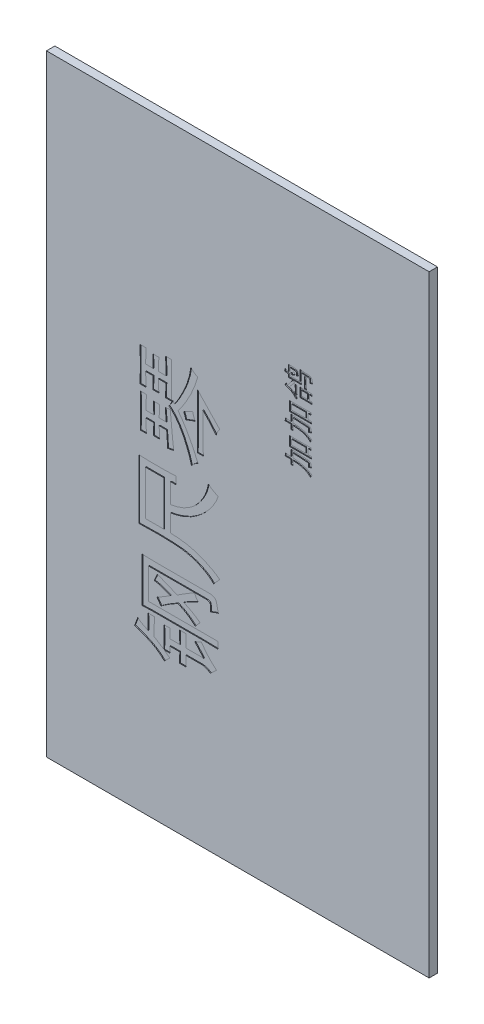
from build123d import *

# Parameters (mm, degrees)
SKETCH_1_W          = 91.41993269
SKETCH_1_H          = 146.13
EXTRUDE_1_DEPTH     = 2
SKETCH_4_W          = 4.425194932
SKETCH_4_H          = 10.637487817
SKETCH_4_W_2        = 3.375629467
SKETCH_4_H_2        = 1.219765269
SKETCH_4_H_3        = 1.21976527
SKETCH_4_W_3        = 1.389965074
SKETCH_4_H_4        = 1.163032001
CUT_EXTRUDE_1_DEPTH = 0.2


with BuildPart() as part:
    # 草图1 → 凸台-拉伸1 (new body)
    with BuildSketch(Plane.XY):
        with Locations((-20.419966345, 50.685)):
            Rectangle(SKETCH_1_W, SKETCH_1_H)
    extrude(amount=EXTRUDE_1_DEPTH)

    # 草图4 → 切除-拉伸1 (cut)
    # profile 1 of 18: a face of its own
    with BuildSketch(Plane.XY.offset(2)):
        with BuildLine():
            add(Edge.make_bspline(
                [(-43.803001095, 66.025521944), (-43.78954932, 66.259769099), (-43.763499272, 66.713400678), (-43.739446042, 67.373344913), (-43.722516649, 67.990088426), (-43.719401077, 68.387296809), (-43.717901192, 68.57851902)],
                knots=[0, 0, 0, 0, 1.102078905, 2.134232082, 3.101790691, 4, 4, 4, 4], degree=3))
            Line((-43.717901192, 68.57851902), (-43.717901192, 71.386815804))
            add(Edge.make_bspline(
                [(-43.717901192, 71.386815804), (-43.719451638, 71.58328983), (-43.722751909, 72.001503353), (-43.739910631, 72.666560951), (-43.763981957, 73.406319764), (-43.789594281, 73.924086656), (-43.803001095, 74.195112587)],
                knots=[0, 0, 0, 0, 0.839097459, 1.786098198, 2.841129462, 4, 4, 4, 4], degree=3))
            Line((-43.803001095, 74.195112587), (-42.356302752, 74.195112587))
            add(Edge.make_bspline(
                [(-42.356302752, 74.195112587), (-42.36258684, 74.084798646), (-42.375691967, 73.854744846), (-42.396549739, 73.495593189), (-42.406339895, 73.10980798), (-42.420623896, 72.697000018), (-42.429638044, 72.258855256), (-42.434725536, 71.793402438), (-42.443228198, 71.301741132), (-42.442022421, 70.964472132), (-42.441402654, 70.791116486)],
                knots=[0, 0, 0, 0, 0.778675858, 1.623886681, 2.535045647, 3.498005879, 4.534787375, 5.623258821, 6.778359398, 8, 8, 8, 8], degree=3))
            Line((-42.441402654, 70.791116486), (-40.654304701, 70.791116486))
            add(Edge.make_bspline(
                [(-40.654304701, 70.791116486), (-40.655546846, 71.087402285), (-40.657894779, 71.647449143), (-40.674245434, 72.439654889), (-40.695958691, 73.136587474), (-40.725636498, 73.56900586), (-40.739404603, 73.769613075)],
                knots=[0, 0, 0, 0, 1.192950867, 2.25494569, 3.190435709, 4, 4, 4, 4], degree=3))
            Line((-40.739404603, 73.769613075), (-39.29270626, 73.769613075))
            add(Edge.make_bspline(
                [(-39.29270626, 73.769613075), (-39.299041866, 73.6855686), (-39.312500843, 73.507029607), (-39.333330533, 73.22144772), (-39.343002428, 72.900738993), (-39.357077227, 72.54572356), (-39.366222589, 72.155900934), (-39.371148659, 71.732466825), (-39.379685512, 71.273376803), (-39.378448971, 70.956067673), (-39.377806163, 70.791116486)],
                knots=[0, 0, 0, 0, 0.678691969, 1.44177213, 2.305344128, 3.261910389, 4.302786264, 5.444996677, 6.671797342, 8, 8, 8, 8], degree=3))
            Line((-39.377806163, 70.791116486), (-37.59070821, 70.791116486))
            Line((-37.59070821, 70.791116486), (-37.59070821, 72.578214439))
            add(Edge.make_bspline(
                [(-37.59070821, 72.578214439), (-37.591978664, 72.794656729), (-37.594396587, 73.206588878), (-37.610664487, 73.791842977), (-37.632712425, 74.313415584), (-37.662063175, 74.638551137), (-37.675808112, 74.790811905)],
                knots=[0, 0, 0, 0, 1.172564309, 2.231619973, 3.171868786, 4, 4, 4, 4], degree=3))
            Line((-37.675808112, 74.790811905), (-36.229109769, 74.790811905))
            add(Edge.make_bspline(
                [(-36.229109769, 74.790811905), (-36.242854706, 74.638551137), (-36.272205456, 74.313415584), (-36.294253394, 73.791842977), (-36.310521294, 73.206588878), (-36.312939217, 72.794656729), (-36.314209672, 72.578214439)],
                knots=[0, 0, 0, 0, 0.828131214, 1.768380027, 2.827435691, 4, 4, 4, 4], degree=3))
            Line((-36.314209672, 72.578214439), (-36.314209672, 69.174218338))
            add(Edge.make_bspline(
                [(-36.314209672, 69.174218338), (-36.314712838, 69.083859877), (-36.315771949, 68.893664719), (-36.306908623, 68.594293319), (-36.302141024, 68.26645314), (-36.292328756, 67.909236835), (-36.278501787, 67.522684967), (-36.268290591, 67.106479875), (-36.2467732, 66.661193688), (-36.235130265, 66.354375639), (-36.229109769, 66.195721749)],
                knots=[0, 0, 0, 0, 0.727693904, 1.53171994, 2.411884578, 3.368377428, 4.409699142, 5.527137373, 6.721296624, 8, 8, 8, 8], degree=3))
            Line((-36.229109769, 66.195721749), (-37.675808112, 66.195721749))
            add(Edge.make_bspline(
                [(-37.675808112, 66.195721749), (-37.662280682, 66.461489468), (-37.635554544, 66.986566652), (-37.61198161, 67.763138138), (-37.595049505, 68.518560676), (-37.592142904, 69.014515593), (-37.59070821, 69.25931824)],
                knots=[0, 0, 0, 0, 1.041813808, 2.058311158, 3.041585129, 4, 4, 4, 4], degree=3))
            Line((-37.59070821, 69.25931824), (-39.377806163, 69.25931824))
            add(Edge.make_bspline(
                [(-39.377806163, 69.25931824), (-39.376518933, 68.986146588), (-39.374048217, 68.461819632), (-39.357522396, 67.706384222), (-39.335273965, 67.014761582), (-39.306418967, 66.574938068), (-39.29270626, 66.365921554)],
                knots=[0, 0, 0, 0, 1.132231955, 2.173211342, 3.131858611, 4, 4, 4, 4], degree=3))
            Line((-39.29270626, 66.365921554), (-40.739404603, 66.365921554))
            add(Edge.make_bspline(
                [(-40.739404603, 66.365921554), (-40.725651648, 66.564427427), (-40.69620186, 66.989496495), (-40.67430462, 67.670660929), (-40.657961331, 68.436603985), (-40.655565536, 68.975639888), (-40.654304701, 69.25931824)],
                knots=[0, 0, 0, 0, 0.824659893, 1.765879299, 2.824249602, 4, 4, 4, 4], degree=3))
            Line((-40.654304701, 69.25931824), (-42.441402654, 69.25931824))
            add(Edge.make_bspline(
                [(-42.441402654, 69.25931824), (-42.440102737, 68.957781373), (-42.437597834, 68.376728729), (-42.421058564, 67.536197507), (-42.398654514, 66.759522237), (-42.370000156, 66.262912279), (-42.356302752, 66.025521944)],
                knots=[0, 0, 0, 0, 1.118388523, 2.155101673, 3.118098569, 4, 4, 4, 4], degree=3))
            Line((-42.356302752, 66.025521944), (-43.803001095, 66.025521944))
        make_face()
    # profile 2 of 18: a face of its own
    with BuildSketch(Plane.XY.offset(2)):
        with BuildLine():
            add(Edge.make_bspline(
                [(-40.484104896, 61.259927402), (-40.485341171, 61.541505654), (-40.487675545, 62.073190414), (-40.504027358, 62.823370625), (-40.525453968, 63.47832639), (-40.5554177, 63.882331049), (-40.569204798, 64.068224186)],
                knots=[0, 0, 0, 0, 1.202339285, 2.270294216, 3.204117013, 4, 4, 4, 4], degree=3))
            Line((-40.569204798, 64.068224186), (-39.122506455, 64.068224186))
            add(Edge.make_bspline(
                [(-39.122506455, 64.068224186), (-39.136293554, 63.882331049), (-39.166257286, 63.47832639), (-39.187683895, 62.823370625), (-39.204035709, 62.073190414), (-39.206370082, 61.541505654), (-39.207606358, 61.259927402)],
                knots=[0, 0, 0, 0, 0.795882987, 1.729705784, 2.797660715, 4, 4, 4, 4], degree=3))
            Line((-39.207606358, 61.259927402), (-37.505608307, 61.259927402))
            Line((-37.505608307, 61.259927402), (-37.760908015, 64.153324088))
            Line((-37.760908015, 64.153324088), (-36.569509379, 64.323523893))
            add(Edge.make_bspline(
                [(-36.569509379, 64.323523893), (-36.52740105, 63.893830104), (-36.445039952, 63.053377564), (-36.325790672, 61.822004249), (-36.211080609, 60.648588274), (-36.123907888, 59.709970641), (-36.050407019, 58.999011193), (-36.000767747, 58.506080338), (-35.95070918, 58.046901045), (-35.899636831, 57.621592872), (-35.852107799, 57.229743448), (-35.808772838, 56.870200235), (-35.76532309, 56.54332575), (-35.733534688, 56.336694473), (-35.718510354, 56.239033153)],
                knots=[0, 0, 0, 0, 1.911840902, 3.739433942, 5.478149202, 7.132617866, 7.913555649, 8.643111051, 9.326403401, 9.958850327, 10.539932526, 11.07427128, 11.562467547, 12, 12, 12, 12], degree=3))
            Line((-35.718510354, 56.239033153), (-37.165208697, 55.983733445))
            Line((-37.165208697, 55.983733445), (-37.420508405, 59.643029254))
            Line((-37.420508405, 59.643029254), (-39.207606358, 59.643029254))
            add(Edge.make_bspline(
                [(-39.207606358, 59.643029254), (-39.206242454, 59.405579094), (-39.2035566, 58.937982475), (-39.18689845, 58.246633293), (-39.163804263, 57.576092796), (-39.1361228, 57.1362087), (-39.122506455, 56.919832373)],
                knots=[0, 0, 0, 0, 1.045653089, 2.05914306, 3.045304206, 4, 4, 4, 4], degree=3))
            Line((-39.122506455, 56.919832373), (-40.569204798, 56.919832373))
            add(Edge.make_bspline(
                [(-40.569204798, 56.919832373), (-40.544778099, 57.373591845), (-40.495947634, 58.280684788), (-40.488051239, 59.189056632), (-40.484104896, 59.643029254)],
                knots=[0, 0, 0, 0, 1.000469632, 2, 2, 2, 2], degree=3))
            Line((-40.484104896, 59.643029254), (-42.356302752, 59.643029254))
            add(Edge.make_bspline(
                [(-42.356302752, 59.643029254), (-42.354941527, 59.364606662), (-42.35227023, 58.818224124), (-42.335781994, 58.01551063), (-42.312570138, 57.244141604), (-42.284821692, 56.741183148), (-42.271202849, 56.49433286)],
                knots=[0, 0, 0, 0, 1.060566986, 2.081279671, 3.058298631, 4, 4, 4, 4], degree=3))
            Line((-42.271202849, 56.49433286), (-43.717901192, 56.49433286))
            add(Edge.make_bspline(
                [(-43.717901192, 56.49433286), (-43.704514017, 56.751699803), (-43.679057622, 57.241096137), (-43.65487884, 57.937779874), (-43.637667869, 58.559761657), (-43.63435488, 58.949613242), (-43.63280129, 59.132429839)],
                knots=[0, 0, 0, 0, 1.171533282, 2.227730127, 3.168913611, 4, 4, 4, 4], degree=3))
            Line((-43.63280129, 59.132429839), (-43.63280129, 62.110926428))
            add(Edge.make_bspline(
                [(-43.63280129, 62.110926428), (-43.63697377, 62.515522462), (-43.645464349, 63.338834768), (-43.693481074, 64.160794974), (-43.717901192, 64.578823601)],
                knots=[0, 0, 0, 0, 0.982849476, 2, 2, 2, 2], degree=3))
            Line((-43.717901192, 64.578823601), (-42.271202849, 64.578823601))
            add(Edge.make_bspline(
                [(-42.271202849, 64.578823601), (-42.27757106, 64.487426482), (-42.291254842, 64.291035666), (-42.31176269, 63.975996868), (-42.321499445, 63.620649301), (-42.335675731, 63.225702971), (-42.344684126, 62.790704694), (-42.349673602, 62.315795536), (-42.358171816, 61.801019056), (-42.356941484, 61.444839756), (-42.356302752, 61.259927402)],
                knots=[0, 0, 0, 0, 0.662174328, 1.422856183, 2.281421018, 3.231052247, 4.279156334, 5.425824534, 6.663603289, 8, 8, 8, 8], degree=3))
            Line((-42.356302752, 61.259927402), (-40.484104896, 61.259927402))
        make_face()
    # profile 3 of 18: a face of its own
    with BuildSketch(Plane.XY.offset(2)):
        with BuildLine():
            add(Edge.make_bspline(
                [(-35.548310549, 65.940422042), (-35.455099344, 66.073333694), (-35.262496112, 66.347970351), (-34.979565342, 66.783029117), (-34.693044442, 67.253068044), (-34.402991388, 67.757547173), (-34.111727399, 68.297162388), (-33.809993418, 68.868106472), (-33.509044012, 69.476349678), (-33.205777687, 70.113344948), (-32.909716228, 70.766192015), (-32.645327289, 71.431781358), (-32.405686089, 72.097945162), (-32.193958302, 72.76757491), (-32.010387474, 73.439356571), (-31.858009126, 74.113948612), (-31.724190261, 74.789985879), (-31.663888238, 75.244291237), (-31.633715032, 75.471611125)],
                knots=[0, 0, 0, 0, 0.749330823, 1.548349666, 2.395073583, 3.290166087, 4.234188706, 5.22555808, 6.270959459, 7.366457498, 8.482281397, 9.579184809, 10.671403792, 11.749676423, 12.82028735, 13.88499433, 14.941718722, 16, 16, 16, 16], degree=3))
            add(Edge.make_bspline(
                [(-31.633715032, 75.471611125), (-31.506566045, 75.348432424), (-31.256890235, 75.106552857), (-30.853245838, 74.790060126), (-30.445156861, 74.507963451), (-30.158116562, 74.355342385), (-30.016816884, 74.28021249)],
                knots=[0, 0, 0, 0, 1.052684672, 2.067101772, 3.048503305, 4, 4, 4, 4], degree=3))
            add(Edge.make_bspline(
                [(-30.016816884, 74.28021249), (-30.08949128, 74.035156163), (-30.233394656, 73.549917422), (-30.462193774, 72.834152536), (-30.708291461, 72.139402966), (-30.971447866, 71.466093322), (-31.240726141, 70.808631921), (-31.527834354, 70.173228563), (-31.827416933, 69.557304967), (-32.238541467, 68.775760253), (-32.760659789, 67.852445408), (-33.401096855, 66.819408111), (-34.034197706, 65.870463868), (-34.481009162, 65.28685122), (-34.697311523, 65.004323114)],
                knots=[0, 0, 0, 0, 0.880162897, 1.742820284, 2.587276327, 3.417673855, 4.231956444, 5.033481223, 5.818215043, 6.590101148, 8.074067193, 9.469579934, 10.775018344, 12, 12, 12, 12], degree=3))
            add(Edge.make_bspline(
                [(-34.697311523, 65.004323114), (-34.616623852, 64.907281442), (-34.449136832, 64.705847689), (-34.204808709, 64.378183605), (-33.945877334, 64.023061411), (-33.678337407, 63.635663537), (-33.403385546, 63.215036772), (-33.12249715, 62.760826862), (-32.823127732, 62.279588219), (-32.523113647, 61.761497055), (-32.209821164, 61.214910151), (-31.895448974, 60.634376907), (-31.576866986, 60.022934615), (-31.256421729, 59.378838158), (-30.92702163, 58.70450239), (-30.598408823, 57.996267056), (-30.262176846, 57.25752777), (-30.043325442, 56.752091876), (-29.931716982, 56.49433286)],
                knots=[0, 0, 0, 0, 0.619164472, 1.28522748, 2.004987068, 2.775758734, 3.595067491, 4.470485801, 5.39620508, 6.375861725, 7.407899799, 8.48749918, 9.61503432, 10.790833875, 12.017432198, 13.297446016, 14.621768532, 16, 16, 16, 16], degree=3))
            add(Edge.make_bspline(
                [(-29.931716982, 56.49433286), (-30.083522411, 56.418849391), (-30.384455695, 56.269213847), (-30.788553605, 55.968348736), (-31.159486235, 55.625384454), (-31.361371421, 55.354757849), (-31.463515227, 55.217834322)],
                knots=[0, 0, 0, 0, 1.00663265, 1.995510107, 2.985828373, 4, 4, 4, 4], degree=3))
            add(Edge.make_bspline(
                [(-31.463515227, 55.217834322), (-31.528968643, 55.465234198), (-31.659959279, 55.960350706), (-31.888766082, 56.694343742), (-32.138723354, 57.421960782), (-32.404244791, 58.146249079), (-32.702437818, 58.859063437), (-33.01839057, 59.567547289), (-33.353680355, 60.27021402), (-33.71492886, 60.957256985), (-34.083985139, 61.619711721), (-34.46442986, 62.239726254), (-34.857127823, 62.806241871), (-35.248659821, 63.329892246), (-35.653972508, 63.798655996), (-36.059685451, 64.224303593), (-36.474870594, 64.599097206), (-36.767337063, 64.814310676), (-36.909908989, 64.919223211)],
                knots=[0, 0, 0, 0, 1.085697908, 2.172785884, 3.261052197, 4.349902637, 5.445112564, 6.538606621, 7.641167064, 8.74774813, 9.83146761, 10.858244569, 11.832582617, 12.755324391, 13.630941062, 14.460073659, 15.24931475, 16, 16, 16, 16], degree=3))
            add(Edge.make_bspline(
                [(-36.909908989, 64.919223211), (-36.824761842, 65.025901902), (-36.646442208, 65.249314027), (-36.411194348, 65.631237102), (-36.17756675, 66.060907381), (-36.043717106, 66.373079816), (-35.973810061, 66.536121359)],
                knots=[0, 0, 0, 0, 0.872722412, 1.827701169, 2.865450904, 4, 4, 4, 4], degree=3))
            Line((-35.973810061, 66.536121359), (-35.548310549, 65.940422042))
        make_face()
    # profile 4 of 18: a face of its own
    with BuildSketch(Plane.XY.offset(2)):
        with BuildLine():
            add(Edge.make_bspline(
                [(-30.101916787, 58.621830424), (-30.08841741, 58.857126486), (-30.06197064, 59.31809744), (-30.038283321, 59.993820449), (-30.021290866, 60.637878442), (-30.018282895, 61.056097637), (-30.016816884, 61.259927402)],
                knots=[0, 0, 0, 0, 1.071331666, 2.098856968, 3.073429577, 4, 4, 4, 4], degree=3))
            Line((-30.016816884, 61.259927402), (-30.016816884, 71.642115511))
            add(Edge.make_bspline(
                [(-30.016816884, 71.642115511), (-29.943307622, 71.56748844), (-29.790033292, 71.411883365), (-29.550566551, 71.170150958), (-29.294438607, 70.907271088), (-29.021233183, 70.624694484), (-28.731337049, 70.322041279), (-28.424515705, 69.999537217), (-28.100911158, 69.65605551), (-27.638746759, 69.169463158), (-27.038890819, 68.533853098), (-26.295912642, 67.750274875), (-25.525924141, 66.940088724), (-25.005287739, 66.390171516), (-24.740622927, 66.110621847)],
                knots=[0, 0, 0, 0, 0.493302853, 1.028586899, 1.602385827, 2.221711711, 2.879581163, 3.576005133, 4.317987045, 5.101935218, 6.736374074, 8.433762698, 10.187108086, 12, 12, 12, 12], degree=3))
            add(Edge.make_bspline(
                [(-24.740622927, 66.110621847), (-24.846819095, 65.973082079), (-25.050139283, 65.70975232), (-25.291917016, 65.295438461), (-25.483208662, 64.896786795), (-25.556502482, 64.624292215), (-25.591621952, 64.493723699)],
                knots=[0, 0, 0, 0, 1.130849425, 2.16509242, 3.120785597, 4, 4, 4, 4], degree=3))
            add(Edge.make_bspline(
                [(-25.591621952, 64.493723699), (-25.824322487, 64.794248235), (-26.296577904, 65.404149458), (-27.065300659, 66.292398804), (-27.874690776, 67.19065051), (-28.449091016, 67.77277566), (-28.740318346, 68.067919605)],
                knots=[0, 0, 0, 0, 0.956664683, 1.941508555, 2.956321873, 4, 4, 4, 4], degree=3))
            Line((-28.740318346, 68.067919605), (-28.740318346, 61.259927402))
            add(Edge.make_bspline(
                [(-28.740318346, 61.259927402), (-28.738852335, 61.056097637), (-28.735844365, 60.637878442), (-28.718851909, 59.993820449), (-28.69516459, 59.31809744), (-28.668717821, 58.857126486), (-28.655218444, 58.621830424)],
                knots=[0, 0, 0, 0, 0.926570423, 1.901143032, 2.928668334, 4, 4, 4, 4], degree=3))
            Line((-28.655218444, 58.621830424), (-30.101916787, 58.621830424))
        make_face()
    # profile 5 of 18: a face of its own
    with BuildSketch(Plane.XY.offset(2)):
        with BuildLine():
            add(Edge.make_bspline(
                [(-30.612516202, 64.834123309), (-30.797196771, 64.787535272), (-31.17172501, 64.693055732), (-31.724503941, 64.497486232), (-32.280362833, 64.264936922), (-32.641423013, 64.078151853), (-32.825113668, 63.983124283)],
                knots=[0, 0, 0, 0, 0.960963465, 1.948813326, 2.956451462, 4, 4, 4, 4], degree=3))
            add(Edge.make_bspline(
                [(-32.825113668, 63.983124283), (-32.889108478, 64.240549794), (-33.01934303, 64.76443127), (-33.229051443, 65.261900386), (-33.335713083, 65.514922529)],
                knots=[0, 0, 0, 0, 0.982762408, 2, 2, 2, 2], degree=3))
            add(Edge.make_bspline(
                [(-33.335713083, 65.514922529), (-33.196408479, 65.590333539), (-32.895121326, 65.753432015), (-32.399793447, 65.997852285), (-31.82907973, 66.261187695), (-31.422802439, 66.44109709), (-31.20821552, 66.536121359)],
                knots=[0, 0, 0, 0, 0.80516132, 1.741398024, 2.807055051, 4, 4, 4, 4], degree=3))
            add(Edge.make_bspline(
                [(-31.20821552, 66.536121359), (-31.165817324, 66.372776037), (-31.084010828, 66.057604402), (-30.938187624, 65.611074141), (-30.785811929, 65.204960521), (-30.668672496, 64.954292708), (-30.612516202, 64.834123309)],
                knots=[0, 0, 0, 0, 1.120803451, 2.162568545, 3.119140861, 4, 4, 4, 4], degree=3))
        make_face()
    # profile 6 of 18: a face of its own
    with BuildSketch(Plane.XY.offset(2)):
        with BuildLine():
            add(Edge.make_bspline(
                [(-44.058300802, 51.218138903), (-43.838773668, 51.204476282), (-43.385248941, 51.176250448), (-42.68316734, 51.153504488), (-41.938236884, 51.136950226), (-41.427568878, 51.13436746), (-41.164904116, 51.133039001)],
                knots=[0, 0, 0, 0, 0.911630406, 1.883352296, 2.91129117, 4, 4, 4, 4], degree=3))
            Line((-41.164904116, 51.133039001), (-38.016207722, 51.133039001))
            add(Edge.make_bspline(
                [(-38.016207722, 51.133039001), (-37.76615058, 51.134394862), (-37.276493762, 51.137049883), (-36.558874157, 51.153511146), (-35.87257337, 51.176687075), (-35.426388561, 51.204513495), (-35.207910939, 51.218138903)],
                knots=[0, 0, 0, 0, 1.067833177, 2.091009239, 3.065248851, 4, 4, 4, 4], degree=3))
            Line((-35.207910939, 51.218138903), (-35.207910939, 49.43104095))
            Line((-35.207910939, 49.43104095), (-36.484409477, 49.43104095))
            Line((-36.484409477, 49.43104095), (-36.484409477, 44.665446408))
            add(Edge.make_bspline(
                [(-36.484409477, 44.665446408), (-36.152269826, 44.726291627), (-35.501285481, 44.845546541), (-34.564736346, 45.111336197), (-33.681947504, 45.42789145), (-32.858820982, 45.809912501), (-32.091049281, 46.249153865), (-31.380557415, 46.748856584), (-30.729567968, 47.312057655), (-30.140428506, 47.930155847), (-29.608793026, 48.581191538), (-29.128774791, 49.244766589), (-28.707281133, 49.920176558), (-28.340684344, 50.602530968), (-28.03330769, 51.295982892), (-27.783977753, 51.997659784), (-27.587692322, 52.708456997), (-27.505045325, 53.190357454), (-27.463819808, 53.430736369)],
                knots=[0, 0, 0, 0, 1.202156267, 2.356192364, 3.46307226, 4.539659405, 5.584044376, 6.60985997, 7.628689225, 8.645041247, 9.647442562, 10.620609487, 11.560341015, 12.481156986, 13.377503897, 14.259319919, 15.131723608, 16, 16, 16, 16], degree=3))
            add(Edge.make_bspline(
                [(-27.463819808, 53.430736369), (-27.278510187, 53.281945377), (-26.912603094, 52.988146928), (-26.322244452, 52.618460713), (-25.715708264, 52.302501052), (-25.29198439, 52.146705006), (-25.081022537, 52.069137929)],
                knots=[0, 0, 0, 0, 1.032528994, 2.038802303, 3.023567173, 4, 4, 4, 4], degree=3))
            add(Edge.make_bspline(
                [(-25.081022537, 52.069137929), (-25.179039082, 51.808020036), (-25.376180833, 51.282830756), (-25.745689544, 50.518412089), (-26.17616222, 49.771474718), (-26.662534196, 49.037932071), (-27.209964817, 48.321840572), (-27.816438669, 47.620001468), (-28.486903747, 46.938241289), (-29.206363812, 46.271503314), (-29.975450663, 45.644778923), (-30.788679159, 45.072400903), (-31.645714328, 44.571163507), (-32.536071326, 44.119243334), (-33.467348425, 43.736022566), (-34.437394575, 43.413647628), (-35.445059555, 43.150353295), (-36.13570408, 43.026155593), (-36.484409477, 42.963448357)],
                knots=[0, 0, 0, 0, 0.875196288, 1.76029189, 2.661493914, 3.579882595, 4.521187876, 5.489212097, 6.489754303, 7.521400362, 8.567038037, 9.601868676, 10.639806007, 11.681128059, 12.733986283, 13.797795615, 14.888110272, 16, 16, 16, 16], degree=3))
            Line((-36.484409477, 42.963448357), (-36.484409477, 38.793553133))
            add(Edge.make_bspline(
                [(-36.484409477, 38.793553133), (-36.163875435, 38.783003164), (-35.531724935, 38.762196736), (-34.600181315, 38.696041825), (-33.700091354, 38.599089224), (-32.83292433, 38.46916705), (-31.996503071, 38.312943897), (-31.192758243, 38.12441469), (-30.42073187, 37.903358349), (-29.681390628, 37.65087089), (-28.971990158, 37.373814074), (-28.286594049, 37.088510999), (-27.629078245, 36.78563313), (-26.997228688, 36.471361188), (-26.394071895, 36.139456732), (-25.816857627, 35.79255674), (-25.265077344, 35.431894174), (-24.913982166, 35.175671662), (-24.740622927, 35.049157422)],
                knots=[0, 0, 0, 0, 1.228407993, 2.422640419, 3.57637481, 4.695332119, 5.780629566, 6.834890455, 7.856467681, 8.855513445, 9.826349778, 10.773337129, 11.698935193, 12.598830359, 13.475995064, 14.335279508, 15.178015835, 16, 16, 16, 16], degree=3))
            add(Edge.make_bspline(
                [(-24.740622927, 35.049157422), (-24.845690094, 34.930442708), (-25.065191854, 34.682429084), (-25.409827782, 34.29279718), (-25.786293288, 33.871897501), (-26.050487166, 33.582267517), (-26.18732127, 33.432259274)],
                knots=[0, 0, 0, 0, 0.876809199, 1.831791694, 2.877018484, 4, 4, 4, 4], degree=3))
            add(Edge.make_bspline(
                [(-26.18732127, 33.432259274), (-26.291086447, 33.538650787), (-26.502460166, 33.755374454), (-26.850497173, 34.061581667), (-27.234596895, 34.353077129), (-27.647799984, 34.642627602), (-28.098314767, 34.916475117), (-28.578892713, 35.186377426), (-29.093548321, 35.444270095), (-29.637525966, 35.690304651), (-30.200060295, 35.923120608), (-30.774947453, 36.130196352), (-31.354679329, 36.317272472), (-31.941513706, 36.478120834), (-32.53594678, 36.61323316), (-33.136066661, 36.727076582), (-33.743994885, 36.815402425), (-34.565747266, 36.901256547), (-35.607340859, 36.976282065), (-36.873626815, 37.042309824), (-38.160895667, 37.085226839), (-39.026866889, 37.089435774), (-39.462906065, 37.091555083)],
                knots=[0, 0, 0, 0, 0.630021697, 1.283378801, 1.963247822, 2.67383298, 3.421849438, 4.19768477, 5.010547054, 5.861857679, 6.728864595, 7.591327251, 8.452143027, 9.311343417, 10.170497608, 11.036370695, 11.900764136, 12.774497705, 14.539261465, 16.328134823, 18.151119776, 20, 20, 20, 20], degree=3))
            add(Edge.make_bspline(
                [(-39.462906065, 37.091555083), (-39.888412447, 37.090239975), (-40.711088018, 37.087697341), (-41.902515488, 37.071246239), (-43.00899656, 37.048640357), (-43.717935011, 37.020138905), (-44.058300802, 37.00645518)],
                knots=[0, 0, 0, 0, 1.110856996, 2.147734915, 3.110715932, 4, 4, 4, 4], degree=3))
            Line((-44.058300802, 37.00645518), (-44.058300802, 51.218138903))
        make_face()
        with Locations((-40.313905091, 44.112297041)):
            Rectangle(SKETCH_4_W, SKETCH_4_H, mode=Mode.SUBTRACT)
    # profile 7 of 18: a face of its own
    with BuildSketch(Plane.XY.offset(2)):
        with BuildLine():
            add(Edge.make_bspline(
                [(-43.292401679, 31.049462003), (-42.668413319, 31.025035244), (-41.420746695, 30.976193867), (-40.172149434, 30.968305369), (-39.548005968, 30.9643621)],
                knots=[0, 0, 0, 0, 1.000248541, 2, 2, 2, 2], degree=3))
            Line((-39.548005968, 30.9643621), (-27.378719906, 30.9643621))
            add(Edge.make_bspline(
                [(-27.378719906, 30.9643621), (-27.257764456, 30.962504319), (-27.027681523, 30.958970426), (-26.702531852, 30.917746089), (-26.416659163, 30.853197937), (-26.169595257, 30.763578555), (-25.962767167, 30.642264042), (-25.795634869, 30.492815442), (-25.668407343, 30.314917831), (-25.556785548, 30.033547407), (-25.457039714, 29.636926777), (-25.329351938, 29.115638671), (-25.19970782, 28.530754799), (-25.121841016, 28.117432748), (-25.081022537, 27.900765609)],
                knots=[0, 0, 0, 0, 0.989951032, 1.883096933, 2.678171169, 3.38603163, 4.026368048, 4.629381085, 5.209434564, 5.79910564, 7.095459714, 8.556082185, 10.194667288, 12, 12, 12, 12], degree=3))
            add(Edge.make_bspline(
                [(-25.081022537, 27.900765609), (-25.395343186, 27.808311146), (-26.033630942, 27.620564807), (-26.643617661, 27.354837841), (-26.953220393, 27.219966389)],
                knots=[0, 0, 0, 0, 0.984886975, 2, 2, 2, 2], degree=3))
            add(Edge.make_bspline(
                [(-26.953220393, 27.219966389), (-26.947472014, 27.348120435), (-26.936638303, 27.589646604), (-26.928812378, 27.930170851), (-26.935131828, 28.22775568), (-26.950428684, 28.483243257), (-26.972585445, 28.697772359), (-27.010054427, 28.868776923), (-27.053687141, 29.000329636), (-27.137276999, 29.121274119), (-27.294347179, 29.214831909), (-27.521062076, 29.298325632), (-27.813435459, 29.339574244), (-28.027960829, 29.344684831), (-28.144619028, 29.347463952)],
                knots=[0, 0, 0, 0, 1.549404359, 2.920092725, 4.113164711, 5.142961135, 6.011790154, 6.713732155, 7.255822847, 7.674764715, 8.459662311, 9.407211794, 10.590050193, 12, 12, 12, 12], degree=3))
            Line((-28.144619028, 29.347463952), (-41.760603434, 29.347463952))
            Line((-41.760603434, 29.347463952), (-41.760603434, 22.028872334))
            Line((-41.760603434, 22.028872334), (-25.16612244, 22.028872334))
            Line((-25.16612244, 22.028872334), (-25.16612244, 20.411974186))
            add(Edge.make_bspline(
                [(-25.16612244, 20.411974186), (-25.6976426, 20.436396174), (-26.746675371, 20.484596538), (-27.796778292, 20.492952095), (-28.314818833, 20.497074088)],
                knots=[0, 0, 0, 0, 1.013352823, 2, 2, 2, 2], degree=3))
            Line((-28.314818833, 20.497074088), (-40.994704311, 20.497074088))
            add(Edge.make_bspline(
                [(-40.994704311, 20.497074088), (-41.037786763, 20.497453625), (-41.138700947, 20.498342634), (-41.312995824, 20.489077471), (-41.532660345, 20.48480528), (-41.797406688, 20.474701021), (-42.107249441, 20.460954407), (-42.462542579, 20.45078045), (-42.862627089, 20.429229127), (-43.14424945, 20.417922322), (-43.292401679, 20.411974186)],
                knots=[0, 0, 0, 0, 0.449598316, 1.053116632, 1.821036758, 2.742752281, 3.81829671, 5.058209628, 6.452421169, 8, 8, 8, 8], degree=3))
            Line((-43.292401679, 20.411974186), (-43.292401679, 31.049462003))
        make_face()
    # profile 8 of 18: a face of its own
    with BuildSketch(Plane.XY.offset(2)):
        with BuildLine():
            add(Edge.make_bspline(
                [(-40.313905091, 19.56097516), (-40.327278717, 19.385571438), (-40.352650717, 19.052801295), (-40.376967242, 18.578797363), (-40.394012355, 18.158521182), (-40.397422944, 17.895761808), (-40.399004993, 17.773877207)],
                knots=[0, 0, 0, 0, 1.179598962, 2.237896141, 3.182623546, 4, 4, 4, 4], degree=3))
            Line((-40.399004993, 17.773877207), (-40.399004993, 15.391079936))
            add(Edge.make_bspline(
                [(-40.399004993, 15.391079936), (-40.330912605, 15.345599191), (-40.188171456, 15.250258521), (-39.959169323, 15.106363647), (-39.709418033, 14.943532409), (-39.434663498, 14.768291772), (-39.133298864, 14.583329728), (-38.812427209, 14.379990098), (-38.465444749, 14.166092757), (-38.225351956, 14.019908122), (-38.101307625, 13.944381593)],
                knots=[0, 0, 0, 0, 0.72371059, 1.517104685, 2.390282694, 3.358877156, 4.397329919, 5.515509442, 6.716383916, 8, 8, 8, 8], degree=3))
            add(Edge.make_bspline(
                [(-38.101307625, 13.944381593), (-38.076878451, 14.348750022), (-38.027225329, 15.170642543), (-38.01991924, 15.994006951), (-38.016207722, 16.412278767)],
                knots=[0, 0, 0, 0, 0.983993451, 2, 2, 2, 2], degree=3))
            add(Edge.make_bspline(
                [(-38.016207722, 16.412278767), (-38.01993376, 16.858908516), (-38.027275626, 17.738957455), (-38.076878491, 18.617632962), (-38.101307625, 19.050375745)],
                knots=[0, 0, 0, 0, 1.015011164, 2, 2, 2, 2], degree=3))
            Line((-38.101307625, 19.050375745), (-36.569509379, 19.050375745))
            add(Edge.make_bspline(
                [(-36.569509379, 19.050375745), (-36.593936013, 18.681740776), (-36.642754572, 17.94499463), (-36.650659585, 17.206675426), (-36.654609282, 16.837778279)],
                knots=[0, 0, 0, 0, 1.000710956, 2, 2, 2, 2], degree=3))
            Line((-36.654609282, 16.837778279), (-34.271812011, 16.837778279))
            add(Edge.make_bspline(
                [(-34.271812011, 16.837778279), (-34.273271036, 17.069973556), (-34.2762554, 17.54491759), (-34.293216425, 18.274073344), (-34.31688388, 19.034879585), (-34.343405217, 19.552607937), (-34.356911913, 19.816274868)],
                knots=[0, 0, 0, 0, 0.935011096, 1.912519272, 2.936894925, 4, 4, 4, 4], degree=3))
            Line((-34.356911913, 19.816274868), (-32.740013765, 19.816274868))
            add(Edge.make_bspline(
                [(-32.740013765, 19.816274868), (-32.753733688, 19.605156867), (-32.78272603, 19.159031524), (-32.805027691, 18.451648483), (-32.821377481, 17.669944466), (-32.823830604, 17.123556961), (-32.825113668, 16.837778279)],
                knots=[0, 0, 0, 0, 0.851805152, 1.799997454, 2.849326123, 4, 4, 4, 4], degree=3))
            Line((-32.825113668, 16.837778279), (-28.570118541, 16.837778279))
            add(Edge.make_bspline(
                [(-28.570118541, 16.837778279), (-28.618389663, 16.893510753), (-28.726125703, 17.01789974), (-28.905937385, 17.222637667), (-29.120420622, 17.465190256), (-29.368305806, 17.745650876), (-29.653388307, 18.059677939), (-29.968043907, 18.415044684), (-30.321577786, 18.804458781), (-30.568447777, 19.077640364), (-30.697616104, 19.22057555)],
                knots=[0, 0, 0, 0, 0.553943272, 1.236342806, 2.047210773, 2.986554349, 4.048497974, 5.233659823, 6.552584159, 8, 8, 8, 8], degree=3))
            add(Edge.make_bspline(
                [(-30.697616104, 19.22057555), (-30.580729991, 19.266143642), (-30.337104445, 19.361121146), (-29.965284504, 19.521480299), (-29.571364463, 19.702599429), (-29.304215096, 19.8335405), (-29.165817859, 19.901374771)],
                knots=[0, 0, 0, 0, 0.89769494, 1.871064187, 2.897100764, 4, 4, 4, 4], degree=3))
            add(Edge.make_bspline(
                [(-29.165817859, 19.901374771), (-29.072780001, 19.778091804), (-28.870221879, 19.509685301), (-28.531684438, 19.083638548), (-28.14481578, 18.594676899), (-27.712700539, 18.056110403), (-27.23158353, 17.495829361), (-26.698793261, 16.94588912), (-26.123280601, 16.410297466), (-25.714226951, 16.072965951), (-25.50652205, 15.901679352)],
                knots=[0, 0, 0, 0, 0.681712053, 1.484194882, 2.401812319, 3.433868572, 4.531921756, 5.660113934, 6.8118776, 8, 8, 8, 8], degree=3))
            add(Edge.make_bspline(
                [(-25.50652205, 15.901679352), (-25.643252436, 15.777875608), (-25.907288242, 15.53880204), (-26.286759901, 15.190270167), (-26.629859915, 14.857623942), (-26.848265315, 14.643147785), (-26.953220393, 14.540080911)],
                knots=[0, 0, 0, 0, 1.114017106, 2.151243871, 3.111577174, 4, 4, 4, 4], degree=3))
            add(Edge.make_bspline(
                [(-26.953220393, 14.540080911), (-27.106954037, 14.633731424), (-27.408160222, 14.817218349), (-27.880282102, 15.030937569), (-28.348219872, 15.206502151), (-28.667776272, 15.273117621), (-28.825418249, 15.305980034)],
                knots=[0, 0, 0, 0, 1.060494068, 2.077797443, 3.051748578, 4, 4, 4, 4], degree=3))
            Line((-28.825418249, 15.305980034), (-32.825113668, 15.305980034))
            add(Edge.make_bspline(
                [(-32.825113668, 15.305980034), (-32.825546972, 15.250290448), (-32.826511938, 15.12626999), (-32.81745249, 14.921485217), (-32.812951536, 14.67977199), (-32.802851115, 14.400313984), (-32.789254734, 14.084160736), (-32.778901383, 13.729922659), (-32.757415782, 13.339294511), (-32.745989847, 13.06608101), (-32.740013765, 12.923182763)],
                knots=[0, 0, 0, 0, 0.560449353, 1.248118192, 2.062630547, 2.993728548, 4.062591931, 5.247692815, 6.560466924, 8, 8, 8, 8], degree=3))
            Line((-32.740013765, 12.923182763), (-34.356911913, 12.923182763))
            add(Edge.make_bspline(
                [(-34.356911913, 12.923182763), (-34.343454169, 13.142718414), (-34.317386026, 13.567967012), (-34.293483043, 14.184851002), (-34.276413077, 14.75956699), (-34.273307197, 15.12841489), (-34.271812011, 15.305980034)],
                knots=[0, 0, 0, 0, 1.106780642, 2.143874646, 3.106452372, 4, 4, 4, 4], degree=3))
            Line((-34.271812011, 15.305980034), (-36.654609282, 15.305980034))
            add(Edge.make_bspline(
                [(-36.654609282, 15.305980034), (-36.651054142, 15.057808132), (-36.644127694, 14.574297086), (-36.593938128, 14.093365389), (-36.569509379, 13.859281691)],
                knots=[0, 0, 0, 0, 1.026540775, 2, 2, 2, 2], degree=3))
            Line((-36.569509379, 13.859281691), (-38.016207722, 13.859281691))
            add(Edge.make_bspline(
                [(-38.016207722, 13.859281691), (-37.882055647, 13.752750758), (-37.628760739, 13.551607817), (-37.267532084, 13.274957527), (-36.948741546, 13.039624955), (-36.74741452, 12.901673851), (-36.654609282, 12.83808286)],
                knots=[0, 0, 0, 0, 1.207461421, 2.279829287, 3.207057015, 4, 4, 4, 4], degree=3))
            add(Edge.make_bspline(
                [(-36.654609282, 12.83808286), (-36.877602545, 12.635576611), (-37.323589071, 12.230564112), (-37.72860157, 11.784577585), (-37.93110782, 11.561584322)],
                knots=[0, 0, 0, 0, 1, 2, 2, 2, 2], degree=3))
            add(Edge.make_bspline(
                [(-37.93110782, 11.561584322), (-38.059913136, 11.68820481), (-38.318377837, 11.942285367), (-38.73371797, 12.295305722), (-39.161361915, 12.63802257), (-39.610938846, 12.958803659), (-40.076675383, 13.265607068), (-40.563830764, 13.551518894), (-41.067327969, 13.824158625), (-41.586931106, 14.070447101), (-42.099971978, 14.304166214), (-42.596322035, 14.518693582), (-43.06752287, 14.714587085), (-43.51657085, 14.888193895), (-43.941132889, 15.042658718), (-44.341577764, 15.177937583), (-44.716780838, 15.297371761), (-44.961534042, 15.360603599), (-45.079499633, 15.391079936)],
                knots=[0, 0, 0, 0, 1.057492198, 2.121996298, 3.190582714, 4.266372688, 5.355193264, 6.455841675, 7.573540071, 8.707381294, 9.822604165, 10.875359853, 11.874059368, 12.811049443, 13.69474259, 14.519762954, 15.286558723, 16, 16, 16, 16], degree=3))
            add(Edge.make_bspline(
                [(-45.079499633, 15.391079936), (-44.941987368, 15.73034242), (-44.66876436, 16.404422774), (-44.431466912, 17.09197046), (-44.31360051, 17.433477597)],
                knots=[0, 0, 0, 0, 1.006593597, 2, 2, 2, 2], degree=3))
            add(Edge.make_bspline(
                [(-44.31360051, 17.433477597), (-44.250490903, 17.361002098), (-44.116119092, 17.206688601), (-43.858474369, 17.006301751), (-43.553660158, 16.806561258), (-43.206107712, 16.619621565), (-42.842871745, 16.443451634), (-42.491414999, 16.277505869), (-42.162442799, 16.124103599), (-41.948865573, 16.031505877), (-41.845703336, 15.986779254)],
                knots=[0, 0, 0, 0, 0.79809411, 1.699287264, 2.703194262, 3.830073681, 4.97961819, 6.062921424, 7.064350812, 8, 8, 8, 8], degree=3))
            Line((-41.845703336, 15.986779254), (-41.845703336, 17.773877207))
            add(Edge.make_bspline(
                [(-41.845703336, 17.773877207), (-41.847189246, 17.907320424), (-41.850267245, 18.183742279), (-41.867420424, 18.614530784), (-41.891313811, 19.077030221), (-41.917348415, 19.396085605), (-41.930803239, 19.56097516)],
                knots=[0, 0, 0, 0, 0.894818817, 1.853578487, 2.890717705, 4, 4, 4, 4], degree=3))
            Line((-41.930803239, 19.56097516), (-40.313905091, 19.56097516))
        make_face()
    # profile 9 of 18: a face of its own
    with BuildSketch(Plane.XY.offset(2)):
        with BuildLine():
            add(Edge.make_bspline(
                [(-39.718205773, 23.90107019), (-39.527956217, 24.010180182), (-39.161696491, 24.220233739), (-38.637100455, 24.52436138), (-38.160897975, 24.806189818), (-37.731275399, 25.059235636), (-37.353263958, 25.29522522), (-37.018711058, 25.50027804), (-36.735027885, 25.686943933), (-36.563058797, 25.804571492), (-36.484409477, 25.858367948)],
                knots=[0, 0, 0, 0, 1.392124405, 2.680054095, 3.848945393, 4.904580729, 5.844766938, 6.677489431, 7.395155501, 8, 8, 8, 8], degree=3))
            add(Edge.make_bspline(
                [(-36.484409477, 25.858367948), (-36.691066455, 25.940079567), (-37.089382481, 26.097572662), (-37.671680949, 26.312654684), (-38.216135365, 26.501401973), (-38.72385788, 26.667285409), (-39.194931903, 26.802612717), (-39.629175292, 26.910535264), (-40.02531903, 26.994503647), (-40.279031543, 27.032024185), (-40.399004993, 27.049766583)],
                knots=[0, 0, 0, 0, 1.300381972, 2.506389973, 3.63214257, 4.672315159, 5.631656638, 6.499480969, 7.290447116, 8, 8, 8, 8], degree=3))
            add(Edge.make_bspline(
                [(-40.399004993, 27.049766583), (-40.328274869, 27.180392058), (-40.184572259, 27.445784232), (-39.991969945, 27.863095921), (-39.804012947, 28.298555777), (-39.690736682, 28.5989401), (-39.63310587, 28.751764634)],
                knots=[0, 0, 0, 0, 0.953949859, 1.938142842, 2.95100265, 4, 4, 4, 4], degree=3))
            add(Edge.make_bspline(
                [(-39.63310587, 28.751764634), (-39.241238805, 28.563137554), (-38.47429416, 28.193965091), (-37.291320506, 27.723956798), (-36.087758886, 27.279102377), (-35.281856911, 26.95902904), (-34.867511329, 26.794466876)],
                knots=[0, 0, 0, 0, 1.012273204, 1.981175717, 2.962043833, 4, 4, 4, 4], degree=3))
            add(Edge.make_bspline(
                [(-34.867511329, 26.794466876), (-34.648058993, 26.937545162), (-34.223540852, 27.21432202), (-33.607967994, 27.611169582), (-33.033348189, 27.971768658), (-32.500002614, 28.294626265), (-32.013420159, 28.590858948), (-31.564142618, 28.843538521), (-31.162728286, 29.071093228), (-30.904030203, 29.201303217), (-30.782716007, 29.262364049)],
                knots=[0, 0, 0, 0, 1.316810907, 2.547296273, 3.681401057, 4.726567166, 5.681141351, 6.544452581, 7.317433811, 8, 8, 8, 8], degree=3))
            add(Edge.make_bspline(
                [(-30.782716007, 29.262364049), (-30.712761178, 29.113925155), (-30.578699899, 28.829457186), (-30.345587696, 28.441612721), (-30.111208639, 28.100037842), (-29.931890737, 27.90731433), (-29.846617079, 27.815665706)],
                knots=[0, 0, 0, 0, 1.136450839, 2.177891872, 3.133506333, 4, 4, 4, 4], degree=3))
            add(Edge.make_bspline(
                [(-29.846617079, 27.815665706), (-30.123087601, 27.696403406), (-30.691262686, 27.45130723), (-31.544005011, 27.022271482), (-32.434393687, 26.552468904), (-33.030134538, 26.206188419), (-33.335713083, 26.028567753)],
                knots=[0, 0, 0, 0, 0.920844369, 1.892428982, 2.918945238, 4, 4, 4, 4], degree=3))
            add(Edge.make_bspline(
                [(-33.335713083, 26.028567753), (-32.975012008, 25.868622843), (-32.263487596, 25.553113087), (-31.252927192, 24.999919116), (-30.298695116, 24.404980571), (-29.711892243, 23.954228618), (-29.421117566, 23.730870385)],
                knots=[0, 0, 0, 0, 1.039589029, 2.050709092, 3.034080337, 4, 4, 4, 4], degree=3))
            add(Edge.make_bspline(
                [(-29.421117566, 23.730870385), (-29.520341258, 23.642078637), (-29.72210958, 23.461523353), (-30.002575113, 23.155051301), (-30.273182251, 22.818438666), (-30.441596876, 22.577266497), (-30.527416299, 22.454371847)],
                knots=[0, 0, 0, 0, 0.942669137, 1.916888654, 2.938504213, 4, 4, 4, 4], degree=3))
            add(Edge.make_bspline(
                [(-30.527416299, 22.454371847), (-30.720504578, 22.617734822), (-31.092012493, 22.932050319), (-31.649614825, 23.3613038), (-32.177690632, 23.741420919), (-32.689160968, 24.071496259), (-33.196176198, 24.360954572), (-33.706742609, 24.632163659), (-34.23758328, 24.873665766), (-34.600087915, 25.019247678), (-34.782411426, 25.092468825)],
                knots=[0, 0, 0, 0, 1.205837738, 2.3200697, 3.354313628, 4.307557767, 5.220953644, 6.137421519, 7.063206876, 8, 8, 8, 8], degree=3))
            add(Edge.make_bspline(
                [(-34.782411426, 25.092468825), (-35.126111811, 24.891008928), (-35.823446297, 24.482266487), (-36.69353135, 23.966925754), (-37.381818282, 23.541282168), (-37.875439117, 23.216888937), (-38.340805533, 22.884036823), (-38.636836677, 22.652897712), (-38.782106845, 22.539471749)],
                knots=[0, 0, 0, 0, 1.509870243, 3.063379141, 3.832377069, 4.576703217, 5.301551319, 6, 6, 6, 6], degree=3))
            add(Edge.make_bspline(
                [(-38.782106845, 22.539471749), (-38.854726057, 22.642343396), (-39.004829032, 22.854977765), (-39.233934517, 23.184830849), (-39.474470948, 23.53507983), (-39.635509127, 23.776893536), (-39.718205773, 23.90107019)],
                knots=[0, 0, 0, 0, 0.914453381, 1.89016337, 2.91655251, 4, 4, 4, 4], degree=3))
        make_face()
    # profile 10 of 18: a face of its own
    with BuildSketch(Plane.XY.offset(2)):
        with BuildLine():
            add(Edge.make_bspline(
                [(-8.047937259, 73.209486489), (-7.849397915, 73.201344238), (-7.452427504, 73.185064178), (-7.055132129, 73.18243439), (-6.856538624, 73.181119855)],
                knots=[0, 0, 0, 0, 1.000272758, 2, 2, 2, 2], degree=3))
            Line((-6.856538624, 73.181119855), (-4.360274816, 73.181119855))
            add(Edge.make_bspline(
                [(-4.360274816, 73.181119855), (-4.245755552, 73.181600582), (-4.013904457, 73.182573843), (-3.662989915, 73.188136105), (-3.304690614, 73.19606953), (-3.063805349, 73.204979164), (-2.941943107, 73.209486489)],
                knots=[0, 0, 0, 0, 0.968659918, 1.961109902, 2.968539156, 4, 4, 4, 4], degree=3))
            Line((-2.941943107, 73.209486489), (-2.941943107, 72.670520439))
            Line((-2.941943107, 72.670520439), (-3.594375694, 72.670520439))
            Line((-3.594375694, 72.670520439), (-3.594375694, 71.45075517))
            Line((-3.594375694, 71.45075517), (-2.800109937, 71.45075517))
            Line((-2.800109937, 71.45075517), (-2.800109937, 70.91178912))
            add(Edge.make_bspline(
                [(-2.800109937, 70.91178912), (-2.991644335, 70.91993208), (-3.379149507, 70.936406608), (-3.766997693, 70.938896537), (-3.963141938, 70.940155755)],
                knots=[0, 0, 0, 0, 0.988551441, 2, 2, 2, 2], degree=3))
            Line((-3.963141938, 70.940155755), (-6.856538624, 70.940155755))
            add(Edge.make_bspline(
                [(-6.856538624, 70.940155755), (-6.952147245, 70.939676138), (-7.145828991, 70.938704541), (-7.440010877, 70.933099126), (-7.741584685, 70.925203883), (-7.944987807, 70.916297137), (-8.047937259, 70.91178912)],
                knots=[0, 0, 0, 0, 0.962642255, 1.950098551, 2.962472993, 4, 4, 4, 4], degree=3))
            Line((-8.047937259, 70.91178912), (-8.047937259, 73.209486489))
        make_face()
        with Locations((-5.84952311, 72.060637805)):
            Rectangle(SKETCH_4_W_2, SKETCH_4_H_2, mode=Mode.SUBTRACT)
    # profile 11 of 18: a face of its own
    with BuildSketch(Plane.XY.offset(2)):
        with BuildLine():
            add(Edge.make_bspline(
                [(-3.594375694, 70.287723169), (-3.551446916, 70.280240409), (-3.469528432, 70.265961494), (-3.354640292, 70.230853611), (-3.253862978, 70.187047115), (-3.165242495, 70.135369815), (-3.09163442, 70.073268261), (-3.031089971, 70.002601279), (-2.98489225, 69.922459633), (-2.945135341, 69.802449387), (-2.910438398, 69.644507791), (-2.872305882, 69.449548949), (-2.845480071, 69.247060424), (-2.834192741, 69.109337442), (-2.828476571, 69.039591265)],
                knots=[0, 0, 0, 0, 0.957515726, 1.827171431, 2.634113468, 3.369740377, 4.074740334, 4.741301572, 5.407061601, 6.093953758, 7.511629652, 8.961567179, 10.461265707, 12, 12, 12, 12], degree=3))
            add(Edge.make_bspline(
                [(-2.828476571, 69.039591265), (-2.874142903, 69.037255609), (-2.97235646, 69.032232366), (-3.127271346, 68.998106435), (-3.299432539, 68.943640259), (-3.417862235, 68.895186288), (-3.480909157, 68.86939146)],
                knots=[0, 0, 0, 0, 0.80778963, 1.737295023, 2.795432332, 4, 4, 4, 4], degree=3))
            add(Edge.make_bspline(
                [(-3.480909157, 68.86939146), (-3.478541658, 68.908253465), (-3.47400085, 68.982789867), (-3.471699454, 69.090017398), (-3.468649715, 69.188415073), (-3.469992089, 69.277762638), (-3.473025665, 69.358690716), (-3.477989728, 69.430566701), (-3.485345975, 69.493660031), (-3.494093957, 69.548842096), (-3.508606829, 69.596884021), (-3.530108592, 69.639658368), (-3.560074332, 69.676491682), (-3.597367921, 69.708912695), (-3.643333637, 69.733484797), (-3.695985027, 69.753527153), (-3.755744563, 69.769644124), (-3.798793389, 69.774555177), (-3.821308767, 69.777123753)],
                knots=[0, 0, 0, 0, 1.682816483, 3.227601925, 4.63579948, 5.937790663, 7.089205749, 8.136494844, 9.050960007, 9.834948378, 10.548383545, 11.211888112, 11.890419906, 12.588266079, 13.333746265, 14.129341313, 15.021608949, 16, 16, 16, 16], degree=3))
            Line((-3.821308767, 69.777123753), (-7.225304868, 69.975690193))
            Line((-7.225304868, 69.975690193), (-7.225304868, 68.982857996))
            add(Edge.make_bspline(
                [(-7.225304868, 68.982857996), (-7.135297553, 68.977693337), (-6.960146664, 68.967643103), (-6.704731051, 68.951517682), (-6.463817601, 68.931184562), (-6.236836776, 68.909355164), (-6.023884344, 68.885200453), (-5.825126085, 68.859576387), (-5.641066883, 68.829584025), (-5.417575675, 68.789872628), (-5.157180443, 68.735292864), (-4.862815418, 68.666657376), (-4.589431255, 68.594085875), (-4.333953652, 68.517019766), (-4.089575739, 68.431004574), (-3.850629524, 68.332021556), (-3.613811067, 68.218507111), (-3.384640106, 68.091681082), (-3.168912098, 67.963906427), (-2.974109043, 67.843335833), (-2.805295595, 67.73213108), (-2.70487073, 67.65639753), (-2.658276766, 67.621259556)],
                knots=[0, 0, 0, 0, 1.116489798, 2.172647627, 3.169218877, 4.110414263, 4.996445401, 5.823266363, 6.591883782, 7.305636191, 8.634212253, 9.886055582, 11.048500477, 12.13644959, 13.189905913, 14.255460664, 15.337863314, 16.440273254, 17.497952649, 18.44266866, 19.277447463, 20, 20, 20, 20], degree=3))
            add(Edge.make_bspline(
                [(-2.658276766, 67.621259556), (-2.696057363, 67.585412244), (-2.773893168, 67.511559405), (-2.875539264, 67.377639556), (-2.972471122, 67.22517811), (-3.027122698, 67.112333683), (-3.055409644, 67.053926872)],
                knots=[0, 0, 0, 0, 0.895011094, 1.843907023, 2.884034258, 4, 4, 4, 4], degree=3))
            add(Edge.make_bspline(
                [(-3.055409644, 67.053926872), (-3.100568066, 67.09774793), (-3.189897521, 67.184431896), (-3.329480204, 67.306706862), (-3.471641969, 67.421342895), (-3.618103384, 67.526040094), (-3.766574297, 67.623658601), (-3.918846997, 67.711258361), (-4.073743446, 67.792098529), (-4.282458909, 67.884574335), (-4.54026236, 67.986506633), (-4.84358997, 68.089483632), (-5.136367376, 68.173201901), (-5.417262889, 68.231047378), (-5.679893822, 68.274848047), (-5.918962674, 68.312397891), (-6.133741141, 68.339947471), (-6.331406801, 68.35937156), (-6.528294533, 68.374620158), (-6.739926969, 68.387398721), (-6.974821432, 68.403010093), (-7.139139941, 68.411220146), (-7.225304868, 68.415525313)],
                knots=[0, 0, 0, 0, 0.839132039, 1.659916443, 2.473988579, 3.273785704, 4.060158861, 4.842861386, 5.615803236, 6.38930938, 7.886354418, 9.31171122, 10.660332913, 11.944673091, 13.134121035, 14.211535987, 15.17208507, 16.021668472, 16.860293384, 17.80574505, 18.849382095, 20, 20, 20, 20], degree=3))
            Line((-7.225304868, 68.415525313), (-7.225304868, 68.018392434))
            add(Edge.make_bspline(
                [(-7.225304868, 68.018392434), (-7.223893724, 67.911885229), (-7.221008556, 67.6941249), (-7.20507741, 67.476926092), (-7.196938234, 67.365959848)],
                knots=[0, 0, 0, 0, 0.978205775, 2, 2, 2, 2], degree=3))
            Line((-7.196938234, 67.365959848), (-7.764270918, 67.365959848))
            add(Edge.make_bspline(
                [(-7.764270918, 67.365959848), (-7.75528396, 67.419810854), (-7.736847305, 67.530285661), (-7.71971532, 67.70255135), (-7.708967872, 67.885172574), (-7.70802295, 68.01067116), (-7.707537649, 68.075125703)],
                knots=[0, 0, 0, 0, 0.919447565, 1.886237601, 2.91439741, 4, 4, 4, 4], degree=3))
            Line((-7.707537649, 68.075125703), (-7.707537649, 68.443891947))
            add(Edge.make_bspline(
                [(-7.707537649, 68.443891947), (-7.75482124, 68.445864928), (-7.844145691, 68.44959213), (-7.970497393, 68.456811707), (-8.08157817, 68.460199768), (-8.177503103, 68.464771097), (-8.258396315, 68.468153085), (-8.324616957, 68.469571668), (-8.375706901, 68.472648183), (-8.404794114, 68.472371759), (-8.416703504, 68.472258581)],
                knots=[0, 0, 0, 0, 1.600210528, 3.022992265, 4.279108148, 5.357745338, 6.270249684, 7.016653976, 7.597381467, 8, 8, 8, 8], degree=3))
            add(Edge.make_bspline(
                [(-8.416703504, 68.472258581), (-8.430714502, 68.472394966), (-8.462603252, 68.472705376), (-8.516497241, 68.469643815), (-8.582715777, 68.468164989), (-8.661509591, 68.464816033), (-8.752880286, 68.460248988), (-8.85696017, 68.4568258), (-8.973154164, 68.44968498), (-9.054772205, 68.445882636), (-9.097502724, 68.443891947)],
                knots=[0, 0, 0, 0, 0.493360378, 1.122878362, 1.900312415, 2.826102869, 3.900295255, 5.122358472, 6.493432173, 8, 8, 8, 8], degree=3))
            add(Edge.make_bspline(
                [(-9.097502724, 68.443891947), (-9.092433191, 68.497809449), (-9.082002922, 68.608741576), (-9.069127477, 68.780817122), (-9.053622687, 68.963158787), (-9.045131882, 69.08860549), (-9.040769456, 69.153057801)],
                knots=[0, 0, 0, 0, 0.913414527, 1.879297306, 2.910420232, 4, 4, 4, 4], degree=3))
            add(Edge.make_bspline(
                [(-9.040769456, 69.153057801), (-8.96288382, 69.135478642), (-8.803511314, 69.099507508), (-8.618440897, 69.074480693), (-8.485803796, 69.059768042), (-8.405817007, 69.054298771), (-8.315538113, 69.04638617), (-8.214651436, 69.039358618), (-8.102982436, 69.031509055), (-7.980669204, 69.026105022), (-7.847644445, 69.018120791), (-7.755520641, 69.013586389), (-7.707537649, 69.011224631)],
                knots=[0, 0, 0, 0, 1.782914285, 3.648265985, 4.167497219, 4.763915102, 5.438940641, 6.191967671, 7.023039642, 7.939564039, 8.92681502, 10, 10, 10, 10], degree=3))
            Line((-7.707537649, 69.011224631), (-7.707537649, 70.543022876))
            add(Edge.make_bspline(
                [(-7.707537649, 70.543022876), (-7.62950975, 70.53487996), (-7.469199184, 70.518150104), (-7.308028836, 70.515841289), (-7.225304868, 70.514656242)],
                knots=[0, 0, 0, 0, 0.973459225, 2, 2, 2, 2], degree=3))
            Line((-7.225304868, 70.514656242), (-3.594375694, 70.287723169))
        make_face()
    # profile 12 of 18: a face of its own
    with BuildSketch(Plane.XY.offset(2)):
        with BuildLine():
            add(Edge.make_bspline(
                [(-8.047937259, 80.471344838), (-7.849397915, 80.463202588), (-7.452427504, 80.446922527), (-7.055132129, 80.44429274), (-6.856538624, 80.442978204)],
                knots=[0, 0, 0, 0, 1.000272758, 2, 2, 2, 2], degree=3))
            Line((-6.856538624, 80.442978204), (-4.360274816, 80.442978204))
            add(Edge.make_bspline(
                [(-4.360274816, 80.442978204), (-4.245755552, 80.443458932), (-4.013904457, 80.444432193), (-3.662989915, 80.449994455), (-3.304690614, 80.457927879), (-3.063805349, 80.466837514), (-2.941943107, 80.471344838)],
                knots=[0, 0, 0, 0, 0.968659918, 1.961109902, 2.968539156, 4, 4, 4, 4], degree=3))
            Line((-2.941943107, 80.471344838), (-2.941943107, 79.932378789))
            Line((-2.941943107, 79.932378789), (-3.594375694, 79.932378789))
            Line((-3.594375694, 79.932378789), (-3.594375694, 78.712613519))
            Line((-3.594375694, 78.712613519), (-2.800109937, 78.712613519))
            Line((-2.800109937, 78.712613519), (-2.800109937, 78.17364747))
            add(Edge.make_bspline(
                [(-2.800109937, 78.17364747), (-2.991644335, 78.181790429), (-3.379149507, 78.198264958), (-3.766997693, 78.200754887), (-3.963141938, 78.202014104)],
                knots=[0, 0, 0, 0, 0.988551441, 2, 2, 2, 2], degree=3))
            Line((-3.963141938, 78.202014104), (-6.856538624, 78.202014104))
            add(Edge.make_bspline(
                [(-6.856538624, 78.202014104), (-6.952147245, 78.201534487), (-7.145828991, 78.200562891), (-7.440010877, 78.194957476), (-7.741584685, 78.187062233), (-7.944987807, 78.178155487), (-8.047937259, 78.17364747)],
                knots=[0, 0, 0, 0, 0.962642255, 1.950098551, 2.962472993, 4, 4, 4, 4], degree=3))
            Line((-8.047937259, 78.17364747), (-8.047937259, 80.471344838))
        make_face()
        with Locations((-5.84952311, 79.322496154)):
            Rectangle(SKETCH_4_W_2, SKETCH_4_H_3, mode=Mode.SUBTRACT)
    # profile 13 of 18: a face of its own
    with BuildSketch(Plane.XY.offset(2)):
        with BuildLine():
            add(Edge.make_bspline(
                [(-3.594375694, 77.549581518), (-3.551446916, 77.542098758), (-3.469528432, 77.527819843), (-3.354640292, 77.49271196), (-3.253862978, 77.448905465), (-3.165242495, 77.397228165), (-3.09163442, 77.33512661), (-3.031089971, 77.264459629), (-2.98489225, 77.184317983), (-2.945135341, 77.064307736), (-2.910438398, 76.906366141), (-2.872305882, 76.711407299), (-2.845480071, 76.508918773), (-2.834192741, 76.371195792), (-2.828476571, 76.301449614)],
                knots=[0, 0, 0, 0, 0.957515726, 1.827171431, 2.634113468, 3.369740377, 4.074740334, 4.741301572, 5.407061601, 6.093953758, 7.511629652, 8.961567179, 10.461265707, 12, 12, 12, 12], degree=3))
            add(Edge.make_bspline(
                [(-2.828476571, 76.301449614), (-2.874142903, 76.299113958), (-2.97235646, 76.294090715), (-3.127271346, 76.259964785), (-3.299432539, 76.205498609), (-3.417862235, 76.157044638), (-3.480909157, 76.131249809)],
                knots=[0, 0, 0, 0, 0.80778963, 1.737295023, 2.795432332, 4, 4, 4, 4], degree=3))
            add(Edge.make_bspline(
                [(-3.480909157, 76.131249809), (-3.478541658, 76.170111815), (-3.47400085, 76.244648216), (-3.471699454, 76.351875748), (-3.468649715, 76.450273422), (-3.469992089, 76.539620988), (-3.473025665, 76.620549066), (-3.477989728, 76.69242505), (-3.485345975, 76.755518381), (-3.494093957, 76.810700445), (-3.508606829, 76.858742371), (-3.530108592, 76.901516718), (-3.560074332, 76.938350031), (-3.597367921, 76.970771044), (-3.643333637, 76.995343147), (-3.695985027, 77.015385503), (-3.755744563, 77.031502474), (-3.798793389, 77.036413526), (-3.821308767, 77.038982103)],
                knots=[0, 0, 0, 0, 1.682816483, 3.227601925, 4.63579948, 5.937790663, 7.089205749, 8.136494844, 9.050960007, 9.834948378, 10.548383545, 11.211888112, 11.890419906, 12.588266079, 13.333746265, 14.129341313, 15.021608949, 16, 16, 16, 16], degree=3))
            Line((-3.821308767, 77.038982103), (-7.225304868, 77.237548542))
            Line((-7.225304868, 77.237548542), (-7.225304868, 76.244716346))
            add(Edge.make_bspline(
                [(-7.225304868, 76.244716346), (-7.135297553, 76.239551687), (-6.960146664, 76.229501453), (-6.704731051, 76.213376031), (-6.463817601, 76.193042912), (-6.236836776, 76.171213513), (-6.023884344, 76.147058802), (-5.825126085, 76.121434737), (-5.641066883, 76.091442374), (-5.417575675, 76.051730978), (-5.157180443, 75.997151214), (-4.862815418, 75.928515726), (-4.589431255, 75.855944224), (-4.333953652, 75.778878116), (-4.089575739, 75.692862924), (-3.850629524, 75.593879906), (-3.613811067, 75.48036546), (-3.384640106, 75.353539432), (-3.168912098, 75.225764776), (-2.974109043, 75.105194183), (-2.805295595, 74.993989429), (-2.70487073, 74.91825588), (-2.658276766, 74.883117905)],
                knots=[0, 0, 0, 0, 1.116489798, 2.172647627, 3.169218877, 4.110414263, 4.996445401, 5.823266363, 6.591883782, 7.305636191, 8.634212253, 9.886055582, 11.048500477, 12.13644959, 13.189905913, 14.255460664, 15.337863314, 16.440273254, 17.497952649, 18.44266866, 19.277447463, 20, 20, 20, 20], degree=3))
            add(Edge.make_bspline(
                [(-2.658276766, 74.883117905), (-2.696057363, 74.847270593), (-2.773893168, 74.773417754), (-2.875539264, 74.639497906), (-2.972471122, 74.487036459), (-3.027122698, 74.374192033), (-3.055409644, 74.315785222)],
                knots=[0, 0, 0, 0, 0.895011094, 1.843907023, 2.884034258, 4, 4, 4, 4], degree=3))
            add(Edge.make_bspline(
                [(-3.055409644, 74.315785222), (-3.100568066, 74.359606279), (-3.189897521, 74.446290246), (-3.329480204, 74.568565211), (-3.471641969, 74.683201245), (-3.618103384, 74.787898444), (-3.766574297, 74.885516951), (-3.918846997, 74.97311671), (-4.073743446, 75.053956879), (-4.282458909, 75.146432685), (-4.54026236, 75.248364982), (-4.84358997, 75.351341982), (-5.136367376, 75.435060251), (-5.417262889, 75.492905727), (-5.679893822, 75.536706397), (-5.918962674, 75.57425624), (-6.133741141, 75.60180582), (-6.331406801, 75.62122991), (-6.528294533, 75.636478507), (-6.739926969, 75.649257071), (-6.974821432, 75.664868443), (-7.139139941, 75.673078495), (-7.225304868, 75.677383662)],
                knots=[0, 0, 0, 0, 0.839132039, 1.659916443, 2.473988579, 3.273785704, 4.060158861, 4.842861386, 5.615803236, 6.38930938, 7.886354418, 9.31171122, 10.660332913, 11.944673091, 13.134121035, 14.211535987, 15.17208507, 16.021668472, 16.860293384, 17.80574505, 18.849382095, 20, 20, 20, 20], degree=3))
            Line((-7.225304868, 75.677383662), (-7.225304868, 75.280250784))
            add(Edge.make_bspline(
                [(-7.225304868, 75.280250784), (-7.223893724, 75.173743578), (-7.221008556, 74.95598325), (-7.20507741, 74.738784442), (-7.196938234, 74.627818198)],
                knots=[0, 0, 0, 0, 0.978205775, 2, 2, 2, 2], degree=3))
            Line((-7.196938234, 74.627818198), (-7.764270918, 74.627818198))
            add(Edge.make_bspline(
                [(-7.764270918, 74.627818198), (-7.75528396, 74.681669204), (-7.736847305, 74.792144011), (-7.71971532, 74.9644097), (-7.708967872, 75.147030924), (-7.70802295, 75.272529509), (-7.707537649, 75.336984052)],
                knots=[0, 0, 0, 0, 0.919447565, 1.886237601, 2.91439741, 4, 4, 4, 4], degree=3))
            Line((-7.707537649, 75.336984052), (-7.707537649, 75.705750297))
            add(Edge.make_bspline(
                [(-7.707537649, 75.705750297), (-7.75482124, 75.707723278), (-7.844145691, 75.71145048), (-7.970497393, 75.718670057), (-8.08157817, 75.722058117), (-8.177503103, 75.726629447), (-8.258396315, 75.730011435), (-8.324616957, 75.731430017), (-8.375706901, 75.734506533), (-8.404794114, 75.734230109), (-8.416703504, 75.734116931)],
                knots=[0, 0, 0, 0, 1.600210528, 3.022992265, 4.279108148, 5.357745338, 6.270249684, 7.016653976, 7.597381467, 8, 8, 8, 8], degree=3))
            add(Edge.make_bspline(
                [(-8.416703504, 75.734116931), (-8.430714502, 75.734253316), (-8.462603252, 75.734563726), (-8.516497241, 75.731502165), (-8.582715777, 75.730023338), (-8.661509591, 75.726674382), (-8.752880286, 75.722107338), (-8.85696017, 75.71868415), (-8.973154164, 75.711543329), (-9.054772205, 75.707740985), (-9.097502724, 75.705750297)],
                knots=[0, 0, 0, 0, 0.493360378, 1.122878362, 1.900312415, 2.826102869, 3.900295255, 5.122358472, 6.493432173, 8, 8, 8, 8], degree=3))
            add(Edge.make_bspline(
                [(-9.097502724, 75.705750297), (-9.092433191, 75.759667799), (-9.082002922, 75.870599925), (-9.069127477, 76.042675472), (-9.053622687, 76.225017136), (-9.045131882, 76.35046384), (-9.040769456, 76.414916151)],
                knots=[0, 0, 0, 0, 0.913414527, 1.879297306, 2.910420232, 4, 4, 4, 4], degree=3))
            add(Edge.make_bspline(
                [(-9.040769456, 76.414916151), (-8.96288382, 76.397336992), (-8.803511314, 76.361365857), (-8.618440897, 76.336339043), (-8.485803796, 76.321626392), (-8.405817007, 76.316157121), (-8.315538113, 76.308244519), (-8.214651436, 76.301216968), (-8.102982436, 76.293367405), (-7.980669204, 76.287963371), (-7.847644445, 76.27997914), (-7.755520641, 76.275444738), (-7.707537649, 76.27308298)],
                knots=[0, 0, 0, 0, 1.782914285, 3.648265985, 4.167497219, 4.763915102, 5.438940641, 6.191967671, 7.023039642, 7.939564039, 8.92681502, 10, 10, 10, 10], degree=3))
            Line((-7.707537649, 76.27308298), (-7.707537649, 77.804881226))
            add(Edge.make_bspline(
                [(-7.707537649, 77.804881226), (-7.62950975, 77.79673831), (-7.469199184, 77.780008454), (-7.308028836, 77.777699638), (-7.225304868, 77.776514592)],
                knots=[0, 0, 0, 0, 0.973459225, 2, 2, 2, 2], degree=3))
            Line((-7.225304868, 77.776514592), (-3.594375694, 77.549581518))
        make_face()
    # profile 14 of 18: a face of its own
    with BuildSketch(Plane.XY.offset(2)):
        with BuildLine():
            add(Edge.make_bspline(
                [(-9.267702529, 85.946105235), (-9.245407954, 85.997934511), (-9.201610799, 86.099751873), (-9.152655726, 86.256800286), (-9.11565117, 86.412965116), (-9.103505517, 86.51817359), (-9.097502724, 86.570171187)],
                knots=[0, 0, 0, 0, 1.041312966, 2.045634203, 3.034086132, 4, 4, 4, 4], degree=3))
            add(Edge.make_bspline(
                [(-9.097502724, 86.570171187), (-9.081324718, 86.557833187), (-9.046293275, 86.531116794), (-8.982582331, 86.497371152), (-8.907098238, 86.461433791), (-8.817412136, 86.426223214), (-8.71481969, 86.390507665), (-8.598428105, 86.356472401), (-8.46969388, 86.320484457), (-8.378949033, 86.298155045), (-8.331603601, 86.286504845)],
                knots=[0, 0, 0, 0, 0.593298619, 1.284713788, 2.099090662, 3.035420199, 4.096350709, 5.270941894, 6.57613474, 8, 8, 8, 8], degree=3))
            Line((-8.331603601, 86.286504845), (-8.331603601, 87.846669725))
            add(Edge.make_bspline(
                [(-8.331603601, 87.846669725), (-8.263025525, 87.83766839), (-8.130996121, 87.820338639), (-7.939150458, 87.804874996), (-7.762006734, 87.791384165), (-7.648376589, 87.790404603), (-7.594071113, 87.789936456)],
                knots=[0, 0, 0, 0, 1.12107427, 2.15833944, 3.119843993, 4, 4, 4, 4], degree=3))
            Line((-7.594071113, 87.789936456), (-6.48777238, 87.704836554))
            add(Edge.make_bspline(
                [(-6.48777238, 87.704836554), (-6.462832363, 87.699567629), (-6.414260227, 87.689306091), (-6.344976599, 87.668880986), (-6.282155507, 87.642017944), (-6.22515916, 87.611206026), (-6.175520364, 87.573422066), (-6.130628392, 87.532662194), (-6.09281774, 87.48603629), (-6.060104286, 87.43343213), (-6.031180867, 87.37176974), (-6.005875407, 87.297411008), (-5.979225043, 87.209985396), (-5.954694469, 87.108488885), (-5.930713181, 86.99312799), (-5.906282199, 86.864727243), (-5.884790453, 86.721949538), (-5.870956872, 86.622365228), (-5.863706428, 86.570171187)],
                knots=[0, 0, 0, 0, 0.866045066, 1.68667325, 2.4491647, 3.184236375, 3.881545986, 4.563559833, 5.240049522, 5.913602497, 6.664114937, 7.548602329, 8.580083015, 9.769131435, 11.09472808, 12.583724487, 14.209464655, 16, 16, 16, 16], degree=3))
            add(Edge.make_bspline(
                [(-5.863706428, 86.570171187), (-5.917890756, 86.555582595), (-6.021095992, 86.52779561), (-6.165439599, 86.475037734), (-6.292315236, 86.415180152), (-6.367063048, 86.366451949), (-6.402672477, 86.343238113)],
                knots=[0, 0, 0, 0, 1.144818203, 2.180542568, 3.133220912, 4, 4, 4, 4], degree=3))
            add(Edge.make_bspline(
                [(-6.402672477, 86.343238113), (-6.400789164, 86.382105533), (-6.397176245, 86.45666821), (-6.394064504, 86.564549734), (-6.392669581, 86.664027216), (-6.394469701, 86.755169177), (-6.400167132, 86.837804554), (-6.406527743, 86.911944954), (-6.417964267, 86.977671255), (-6.428659663, 87.036827343), (-6.450712459, 87.090251392), (-6.490030797, 87.134461006), (-6.543100489, 87.171849375), (-6.611829865, 87.200223288), (-6.694415716, 87.223001414), (-6.791937332, 87.239191972), (-6.904285107, 87.249742438), (-6.984335906, 87.250545192), (-7.026738429, 87.250970407)],
                knots=[0, 0, 0, 0, 1.364301205, 2.617255014, 3.783782003, 4.852298188, 5.811990883, 6.687994739, 7.459103397, 8.150310586, 8.793617621, 9.455521508, 10.194890148, 11.052632862, 12.047725925, 13.194308583, 14.513838731, 16, 16, 16, 16], degree=3))
            Line((-7.026738429, 87.250970407), (-7.934470723, 87.307703675))
            Line((-7.934470723, 87.307703675), (-7.934470723, 85.605705625))
            Line((-7.934470723, 85.605705625), (-5.580040086, 85.605705625))
            Line((-5.580040086, 85.605705625), (-5.580040086, 88.130336067))
            add(Edge.make_bspline(
                [(-5.580040086, 88.130336067), (-5.510371364, 88.121396143), (-5.3732273, 88.103797751), (-5.171104236, 88.081069926), (-4.976125211, 88.060352188), (-4.848486146, 88.050216195), (-4.785774329, 88.045236164)],
                knots=[0, 0, 0, 0, 1.055025597, 2.076835812, 3.055108076, 4, 4, 4, 4], degree=3))
            Line((-4.785774329, 88.045236164), (-3.452542523, 87.960136261))
            add(Edge.make_bspline(
                [(-3.452542523, 87.960136261), (-3.409691041, 87.954579573), (-3.327225317, 87.94388598), (-3.21041113, 87.91651543), (-3.10535573, 87.881368503), (-3.012834221, 87.836179833), (-2.933195847, 87.781187681), (-2.865919832, 87.717578243), (-2.811203699, 87.644750443), (-2.769351321, 87.562432636), (-2.736696716, 87.47126658), (-2.705182811, 87.372777506), (-2.675748226, 87.265601532), (-2.649463302, 87.149570901), (-2.626836877, 87.024320207), (-2.605621547, 86.890222485), (-2.58809999, 86.747194666), (-2.578241263, 86.648986883), (-2.573176863, 86.598537821)],
                knots=[0, 0, 0, 0, 1.140827858, 2.195471223, 3.163815737, 4.061582264, 4.905850591, 5.710679037, 6.497005681, 7.299704667, 8.139908614, 9.052705917, 10.03120471, 11.074753986, 12.194265987, 13.392748775, 14.66066239, 16, 16, 16, 16], degree=3))
            add(Edge.make_bspline(
                [(-2.573176863, 86.598537821), (-2.629107993, 86.583222715), (-2.739342979, 86.553038086), (-2.899401879, 86.494225101), (-3.052722133, 86.426021986), (-3.149340998, 86.370677079), (-3.197242815, 86.343238113)],
                knots=[0, 0, 0, 0, 1.028087221, 2.026263004, 3.021458285, 4, 4, 4, 4], degree=3))
            add(Edge.make_bspline(
                [(-3.197242815, 86.343238113), (-3.195423887, 86.399618498), (-3.191967234, 86.506762641), (-3.188090641, 86.659452066), (-3.189113369, 86.795751298), (-3.193637195, 86.915511986), (-3.198724201, 87.019064408), (-3.209709145, 87.105895825), (-3.221044238, 87.17726264), (-3.238034159, 87.23431036), (-3.260817489, 87.281638998), (-3.293367559, 87.321261812), (-3.335577975, 87.355050457), (-3.386489884, 87.384596882), (-3.446801732, 87.408336609), (-3.516282442, 87.427003458), (-3.594598151, 87.44174412), (-3.650346785, 87.446862486), (-3.679475596, 87.449536846)],
                knots=[0, 0, 0, 0, 1.917959829, 3.644852055, 5.192814788, 6.551054196, 7.720130389, 8.715562899, 9.526030111, 10.173843851, 10.732968446, 11.300149282, 11.900836226, 12.562508514, 13.294380757, 14.097467151, 15.005921482, 16, 16, 16, 16], degree=3))
            Line((-3.679475596, 87.449536846), (-5.154540573, 87.534636749))
            Line((-5.154540573, 87.534636749), (-5.154540573, 85.095106209))
            add(Edge.make_bspline(
                [(-5.154540573, 85.095106209), (-5.197964748, 85.097223941), (-5.290753342, 85.1017491), (-5.439203725, 85.10862592), (-5.606308129, 85.111887434), (-5.791897474, 85.116578309), (-5.996076959, 85.119601145), (-6.218814869, 85.121269114), (-6.460450609, 85.124094438), (-6.627853599, 85.123685176), (-6.714705453, 85.123472844)],
                knots=[0, 0, 0, 0, 0.66861065, 1.42868443, 2.285284884, 3.238800757, 4.283755401, 5.425578897, 6.664341382, 8, 8, 8, 8], degree=3))
            add(Edge.make_bspline(
                [(-6.714705453, 85.123472844), (-6.801557278, 85.123681086), (-6.9700108, 85.124084984), (-7.214098054, 85.121264733), (-7.441738483, 85.119578913), (-7.652221185, 85.116571372), (-7.845866039, 85.111864833), (-8.022770256, 85.108549771), (-8.182780299, 85.101709921), (-8.283976649, 85.097219552), (-8.331603601, 85.095106209)],
                knots=[0, 0, 0, 0, 1.288829559, 2.499750325, 3.622327414, 4.667019326, 5.623473634, 6.496799158, 7.29253501, 8, 8, 8, 8], degree=3))
            Line((-8.331603601, 85.095106209), (-8.331603601, 85.804272064))
            add(Edge.make_bspline(
                [(-8.331603601, 85.804272064), (-8.418362548, 85.821909997), (-8.585522563, 85.855893318), (-8.828573999, 85.897313312), (-9.053997837, 85.926893931), (-9.198665392, 85.939899038), (-9.267702529, 85.946105235)],
                knots=[0, 0, 0, 0, 1.121296505, 2.160422031, 3.122130754, 4, 4, 4, 4], degree=3))
        make_face()
    # profile 15 of 18: a face of its own
    with BuildSketch(Plane.XY.offset(2)):
        with BuildLine():
            add(Edge.make_bspline(
                [(-5.580040086, 84.471040258), (-5.480244647, 84.466468291), (-5.269861359, 84.456829922), (-4.938142586, 84.449406717), (-4.5746191, 84.44393247), (-4.321754852, 84.443104692), (-4.190075011, 84.442673623)],
                knots=[0, 0, 0, 0, 0.862183924, 1.81760902, 2.863513136, 4, 4, 4, 4], degree=3))
            add(Edge.make_bspline(
                [(-4.190075011, 84.442673623), (-4.060496677, 84.443119979), (-3.807633184, 84.443991012), (-3.437106288, 84.449520898), (-3.084392871, 84.457155545), (-2.855081049, 84.466492136), (-2.743376668, 84.471040258)],
                knots=[0, 0, 0, 0, 1.074533691, 2.09688096, 3.072936004, 4, 4, 4, 4], degree=3))
            Line((-2.743376668, 84.471040258), (-2.743376668, 83.960440842))
            Line((-2.743376668, 83.960440842), (-3.339075986, 83.960440842))
            Line((-3.339075986, 83.960440842), (-3.339075986, 82.797408841))
            Line((-3.339075986, 82.797408841), (-2.658276766, 82.797408841))
            Line((-2.658276766, 82.797408841), (-2.658276766, 82.286809426))
            add(Edge.make_bspline(
                [(-2.658276766, 82.286809426), (-2.778387176, 82.291343564), (-3.021716025, 82.300529167), (-3.392281085, 82.308294844), (-3.773314024, 82.313813553), (-4.031079633, 82.314717808), (-4.161708377, 82.31517606)],
                knots=[0, 0, 0, 0, 0.959128421, 1.943075671, 2.957605542, 4, 4, 4, 4], degree=3))
            add(Edge.make_bspline(
                [(-4.161708377, 82.31517606), (-4.290586399, 82.31473418), (-4.540998811, 82.313875597), (-4.906272758, 82.308351386), (-5.25023618, 82.300784602), (-5.472538784, 82.291364707), (-5.580040086, 82.286809426)],
                knots=[0, 0, 0, 0, 1.090084931, 2.118055449, 3.089927485, 4, 4, 4, 4], degree=3))
            Line((-5.580040086, 82.286809426), (-5.580040086, 84.471040258))
        make_face()
        with Locations((-4.459558036, 83.378924842)):
            Rectangle(SKETCH_4_W_3, SKETCH_4_H_4, mode=Mode.SUBTRACT)
    # profile 16 of 18: a face of its own
    with BuildSketch(Plane.XY.offset(2)):
        with BuildLine():
            add(Edge.make_bspline(
                [(-8.898936285, 83.705141135), (-8.872671701, 83.685697099), (-8.816111242, 83.643824609), (-8.717439599, 83.588489508), (-8.602349574, 83.531035029), (-8.518175679, 83.496541545), (-8.473436772, 83.478208061)],
                knots=[0, 0, 0, 0, 0.809967204, 1.744254393, 2.801058305, 4, 4, 4, 4], degree=3))
            add(Edge.make_bspline(
                [(-8.473436772, 83.478208061), (-8.414886143, 83.559057518), (-8.303659369, 83.712644668), (-8.146696866, 83.931532183), (-8.005451254, 84.124002957), (-7.878549447, 84.300896208), (-7.749156441, 84.473872613), (-7.602791593, 84.655603938), (-7.43629257, 84.856137908), (-7.316633564, 84.994130674), (-7.253671502, 85.066739575)],
                knots=[0, 0, 0, 0, 1.195547192, 2.271143119, 3.225850361, 4.054744216, 4.878496719, 5.812573857, 6.849022205, 8, 8, 8, 8], degree=3))
            add(Edge.make_bspline(
                [(-7.253671502, 85.066739575), (-7.223260212, 85.03342807), (-7.160100751, 84.964245319), (-7.053674441, 84.864531255), (-6.932103166, 84.765980409), (-6.844930599, 84.702478648), (-6.799805356, 84.669606697)],
                knots=[0, 0, 0, 0, 0.895195981, 1.8591811, 2.891796168, 4, 4, 4, 4], degree=3))
            add(Edge.make_bspline(
                [(-6.799805356, 84.669606697), (-6.855563029, 84.622105957), (-6.965832856, 84.528165553), (-7.122235007, 84.380288492), (-7.271100006, 84.230181942), (-7.412919704, 84.072454603), (-7.555750053, 83.903472992), (-7.709015247, 83.721197968), (-7.874452599, 83.520697828), (-7.988473931, 83.380909398), (-8.047937259, 83.308008256)],
                knots=[0, 0, 0, 0, 0.949867443, 1.878516673, 2.790679729, 3.691096533, 4.628634042, 5.660324822, 6.779834711, 8, 8, 8, 8], degree=3))
            add(Edge.make_bspline(
                [(-8.047937259, 83.308008256), (-7.98413297, 83.275571032), (-7.860701901, 83.212820371), (-7.683022335, 83.119793027), (-7.519944782, 83.02913819), (-7.366334638, 82.939978844), (-7.214979923, 82.844637491), (-7.057078378, 82.737977174), (-6.888431518, 82.617644626), (-6.774002463, 82.53052247), (-6.714705453, 82.485375865)],
                knots=[0, 0, 0, 0, 1.094447872, 2.117238094, 3.066437045, 3.947191735, 4.832670745, 5.801010506, 6.860486069, 8, 8, 8, 8], degree=3))
            add(Edge.make_bspline(
                [(-6.714705453, 82.485375865), (-6.70656322, 82.636629022), (-6.690286398, 82.938993337), (-6.687654267, 83.241783952), (-6.686338819, 83.393108159)],
                knots=[0, 0, 0, 0, 1.000469632, 2, 2, 2, 2], degree=3))
            add(Edge.make_bspline(
                [(-6.686338819, 83.393108159), (-6.686822353, 83.47540932), (-6.687808027, 83.643178445), (-6.693462076, 83.900238359), (-6.701375905, 84.167845051), (-6.710204891, 84.349881057), (-6.714705453, 84.442673623)],
                knots=[0, 0, 0, 0, 0.94054499, 1.917280495, 2.938337019, 4, 4, 4, 4], degree=3))
            Line((-6.714705453, 84.442673623), (-6.232472672, 84.442673623))
            add(Edge.make_bspline(
                [(-6.232472672, 84.442673623), (-6.236973234, 84.349881057), (-6.24580222, 84.167845051), (-6.253716049, 83.900238359), (-6.259370099, 83.643178445), (-6.260355772, 83.47540932), (-6.260839306, 83.393108159)],
                knots=[0, 0, 0, 0, 1.061662981, 2.082719505, 3.05945501, 4, 4, 4, 4], degree=3))
            add(Edge.make_bspline(
                [(-6.260839306, 83.393108159), (-6.259523858, 83.241783952), (-6.256891727, 82.938993337), (-6.240614905, 82.636629022), (-6.232472672, 82.485375865)],
                knots=[0, 0, 0, 0, 0.999530368, 2, 2, 2, 2], degree=3))
            Line((-6.232472672, 82.485375865), (-6.686338819, 82.485375865))
            add(Edge.make_bspline(
                [(-6.686338819, 82.485375865), (-6.638267814, 82.441702339), (-6.540499199, 82.352877482), (-6.392800821, 82.215152011), (-6.243195022, 82.068772209), (-6.142077253, 81.968865087), (-6.090639501, 81.918043182)],
                knots=[0, 0, 0, 0, 0.947302238, 1.926658891, 2.945308951, 4, 4, 4, 4], degree=3))
            add(Edge.make_bspline(
                [(-6.090639501, 81.918043182), (-6.130900982, 81.885888321), (-6.208156944, 81.824187793), (-6.308293189, 81.723345196), (-6.395160173, 81.625694063), (-6.438601409, 81.554841927), (-6.459405745, 81.520910303)],
                knots=[0, 0, 0, 0, 1.133014598, 2.174091213, 3.12555848, 4, 4, 4, 4], degree=3))
            add(Edge.make_bspline(
                [(-6.459405745, 81.520910303), (-6.506327811, 81.576201249), (-6.598477845, 81.684786889), (-6.740107076, 81.839287256), (-6.882719014, 81.982265646), (-7.025608274, 82.118147845), (-7.176773833, 82.245949826), (-7.340479732, 82.368039551), (-7.51825401, 82.48635306), (-7.70609437, 82.600043857), (-7.897080584, 82.703589077), (-8.081874523, 82.797008227), (-8.258693597, 82.875047572), (-8.484826294, 82.960807527), (-8.772294112, 83.050403222), (-9.006128309, 83.10820798), (-9.125869358, 83.137808451)],
                knots=[0, 0, 0, 0, 0.956972844, 1.879394672, 2.765040053, 3.621666084, 4.480906329, 5.3756697, 6.315253055, 7.29810273, 8.272242375, 9.18167449, 10.03010751, 10.821500139, 12.372364214, 14, 14, 14, 14], degree=3))
            add(Edge.make_bspline(
                [(-9.125869358, 83.137808451), (-9.109845415, 83.169551231), (-9.07906002, 83.230535847), (-9.039126286, 83.319966147), (-9.001476935, 83.401017808), (-8.970015836, 83.475183675), (-8.944329282, 83.54282174), (-8.925228149, 83.603456428), (-8.907880734, 83.656157514), (-8.901764719, 83.689651421), (-8.898936285, 83.705141135)],
                knots=[0, 0, 0, 0, 1.392583344, 2.675448071, 3.835695448, 4.893014124, 5.830635597, 6.667854963, 7.383931396, 8, 8, 8, 8], degree=3))
        make_face()
    # profile 17 of 18: a face of its own
    with BuildSketch(Plane.XY.offset(2)):
        with BuildLine():
            add(Edge.make_bspline(
                [(-4.502107987, 86.286504845), (-4.502534808, 86.376861816), (-4.503350475, 86.549536833), (-4.508796601, 86.796096908), (-4.516157044, 87.017895518), (-4.525895686, 87.157135579), (-4.530474621, 87.222603773)],
                knots=[0, 0, 0, 0, 1.157508165, 2.212034548, 3.159330528, 4, 4, 4, 4], degree=3))
            Line((-4.530474621, 87.222603773), (-4.019875206, 87.222603773))
            add(Edge.make_bspline(
                [(-4.019875206, 87.222603773), (-4.024454142, 87.157135579), (-4.034192784, 87.017895518), (-4.041553226, 86.796096908), (-4.046999352, 86.549536833), (-4.04781502, 86.376861816), (-4.04824184, 86.286504845)],
                knots=[0, 0, 0, 0, 0.840669472, 1.787965452, 2.842491835, 4, 4, 4, 4], degree=3))
            Line((-4.04824184, 86.286504845), (-4.04824184, 85.463872454))
            add(Edge.make_bspline(
                [(-4.04824184, 85.463872454), (-4.047004668, 85.324448515), (-4.044569305, 85.049993713), (-4.028018264, 84.776029539), (-4.019875206, 84.641240063)],
                knots=[0, 0, 0, 0, 1.016006549, 2, 2, 2, 2], degree=3))
            Line((-4.019875206, 84.641240063), (-4.530474621, 84.641240063))
            add(Edge.make_bspline(
                [(-4.530474621, 84.641240063), (-4.522331564, 84.776029539), (-4.505780523, 85.049993713), (-4.50334516, 85.324448515), (-4.502107987, 85.463872454)],
                knots=[0, 0, 0, 0, 0.983993451, 2, 2, 2, 2], degree=3))
            Line((-4.502107987, 85.463872454), (-4.502107987, 86.286504845))
        make_face()
    # profile 18 of 18: a face of its own
    with BuildSketch(Plane.XY.offset(2)):
        with BuildLine():
            add(Edge.make_bspline(
                [(-7.735904284, 86.399971382), (-7.681028252, 86.434463555), (-7.565894366, 86.506830632), (-7.383317607, 86.616647999), (-7.183051431, 86.733746771), (-7.042962158, 86.812712842), (-6.970005161, 86.853837529)],
                knots=[0, 0, 0, 0, 0.873523765, 1.832716103, 2.871301698, 4, 4, 4, 4], degree=3))
            add(Edge.make_bspline(
                [(-6.970005161, 86.853837529), (-6.954554044, 86.811544758), (-6.923668191, 86.727004053), (-6.865137336, 86.604249305), (-6.795814426, 86.485145847), (-6.741934479, 86.409721536), (-6.714705453, 86.371604747)],
                knots=[0, 0, 0, 0, 0.985812323, 1.970579547, 2.97440244, 4, 4, 4, 4], degree=3))
            add(Edge.make_bspline(
                [(-6.714705453, 86.371604747), (-6.777024259, 86.346441028), (-6.904719318, 86.29487902), (-7.094173336, 86.201265883), (-7.288272684, 86.095658928), (-7.415542232, 86.015467224), (-7.480604576, 85.974471869)],
                knots=[0, 0, 0, 0, 0.932952811, 1.911677593, 2.932414287, 4, 4, 4, 4], degree=3))
            add(Edge.make_bspline(
                [(-7.480604576, 85.974471869), (-7.519513976, 86.04848398), (-7.596606002, 86.195125755), (-7.689764269, 86.332120005), (-7.735904284, 86.399971382)],
                knots=[0, 0, 0, 0, 1.009427368, 2, 2, 2, 2], degree=3))
        make_face()
    extrude(amount=-CUT_EXTRUDE_1_DEPTH, mode=Mode.SUBTRACT)


solid = part.part
